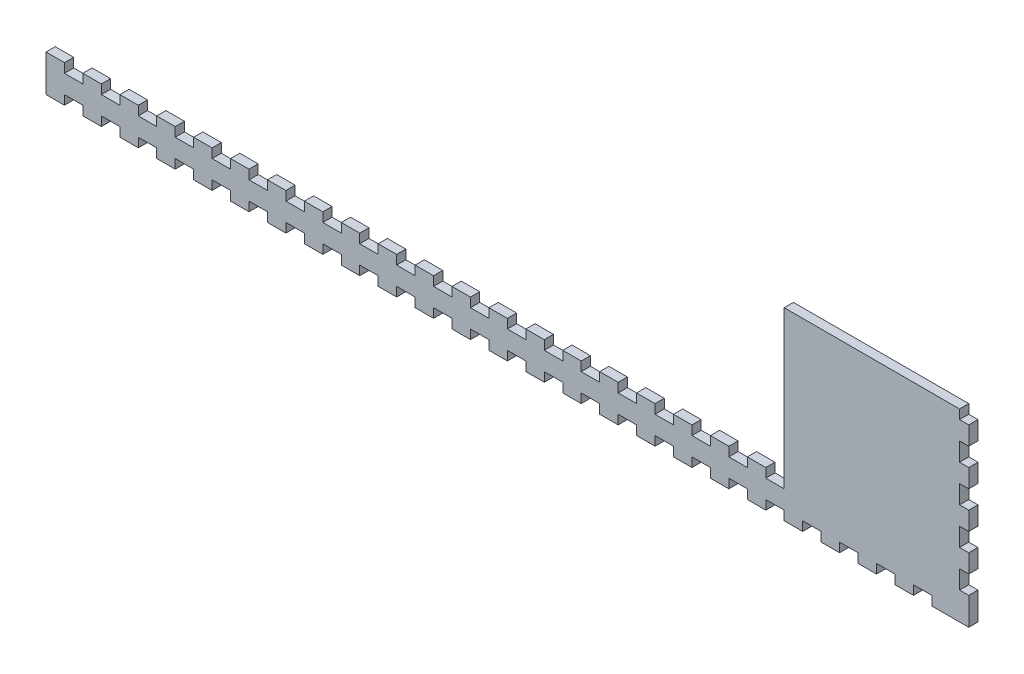
from build123d import *

# Parameters (mm, degrees)
BOSS_EXTRU_1_DEPTH      = 5
ESQUISSE2_W             = 10
ESQUISSE2_H             = 5
ESQUISSE2_W_2           = 5
ESQUISSE2_H_2           = 10
ENL_V_MAT_EXTRU_2_DEPTH = 266.753645318


with BuildPart() as part:
    # Esquisse1 → Boss.-Extru.1 (new body)
    with BuildSketch(Plane.XY):
        Polygon((-250, 10), (150, 10), (150, 90), (250, 90), (250, 10), (250, -10), (-250, -10), align=None)
    extrude(amount=BOSS_EXTRU_1_DEPTH)

    # Esquisse2 → Enlèv. mat.-Extru.2 (cut, through all)
    with BuildSketch(Plane.XY.offset(5)):
        with Locations((-235, 7.5)):
            Rectangle(ESQUISSE2_W, ESQUISSE2_H)
        with Locations((-235, -7.5)):
            Rectangle(ESQUISSE2_W, ESQUISSE2_H)
        with Locations((-215, 7.5)):
            Rectangle(ESQUISSE2_W, ESQUISSE2_H)
        with Locations((-215, -7.5)):
            Rectangle(ESQUISSE2_W, ESQUISSE2_H)
        with Locations((-195, 7.5)):
            Rectangle(ESQUISSE2_W, ESQUISSE2_H)
        with Locations((-195, -7.5)):
            Rectangle(ESQUISSE2_W, ESQUISSE2_H)
        with Locations((-175, 7.5)):
            Rectangle(ESQUISSE2_W, ESQUISSE2_H)
        with Locations((-175, -7.5)):
            Rectangle(ESQUISSE2_W, ESQUISSE2_H)
        with Locations((-155, 7.5)):
            Rectangle(ESQUISSE2_W, ESQUISSE2_H)
        with Locations((-155, -7.5)):
            Rectangle(ESQUISSE2_W, ESQUISSE2_H)
        with Locations((-135, 7.5)):
            Rectangle(ESQUISSE2_W, ESQUISSE2_H)
        with Locations((-135, -7.5)):
            Rectangle(ESQUISSE2_W, ESQUISSE2_H)
        with Locations((-115, 7.5)):
            Rectangle(ESQUISSE2_W, ESQUISSE2_H)
        with Locations((-115, -7.5)):
            Rectangle(ESQUISSE2_W, ESQUISSE2_H)
        with Locations((-95, 7.5)):
            Rectangle(ESQUISSE2_W, ESQUISSE2_H)
        with Locations((-95, -7.5)):
            Rectangle(ESQUISSE2_W, ESQUISSE2_H)
        with Locations((-75, 7.5)):
            Rectangle(ESQUISSE2_W, ESQUISSE2_H)
        with Locations((-75, -7.5)):
            Rectangle(ESQUISSE2_W, ESQUISSE2_H)
        with Locations((-55, 7.5)):
            Rectangle(ESQUISSE2_W, ESQUISSE2_H)
        with Locations((-55, -7.5)):
            Rectangle(ESQUISSE2_W, ESQUISSE2_H)
        with Locations((-35, 7.5)):
            Rectangle(ESQUISSE2_W, ESQUISSE2_H)
        with Locations((-35, -7.5)):
            Rectangle(ESQUISSE2_W, ESQUISSE2_H)
        with Locations((-15, 7.5)):
            Rectangle(ESQUISSE2_W, ESQUISSE2_H)
        with Locations((-15, -7.5)):
            Rectangle(ESQUISSE2_W, ESQUISSE2_H)
        with Locations((5, 7.5)):
            Rectangle(ESQUISSE2_W, ESQUISSE2_H)
        with Locations((5, -7.5)):
            Rectangle(ESQUISSE2_W, ESQUISSE2_H)
        with Locations((25, 7.5)):
            Rectangle(ESQUISSE2_W, ESQUISSE2_H)
        with Locations((25, -7.5)):
            Rectangle(ESQUISSE2_W, ESQUISSE2_H)
        with Locations((45, 7.5)):
            Rectangle(ESQUISSE2_W, ESQUISSE2_H)
        with Locations((45, -7.5)):
            Rectangle(ESQUISSE2_W, ESQUISSE2_H)
        with Locations((65, 7.5)):
            Rectangle(ESQUISSE2_W, ESQUISSE2_H)
        with Locations((65, -7.5)):
            Rectangle(ESQUISSE2_W, ESQUISSE2_H)
        with Locations((85, 7.5)):
            Rectangle(ESQUISSE2_W, ESQUISSE2_H)
        with Locations((85, -7.5)):
            Rectangle(ESQUISSE2_W, ESQUISSE2_H)
        with Locations((105, 7.5)):
            Rectangle(ESQUISSE2_W, ESQUISSE2_H)
        with Locations((105, -7.5)):
            Rectangle(ESQUISSE2_W, ESQUISSE2_H)
        with Locations((125, 7.5)):
            Rectangle(ESQUISSE2_W, ESQUISSE2_H)
        with Locations((125, -7.5)):
            Rectangle(ESQUISSE2_W, ESQUISSE2_H)
        with Locations((145, 7.5)):
            Rectangle(ESQUISSE2_W, ESQUISSE2_H)
        with Locations((145, -7.5)):
            Rectangle(ESQUISSE2_W, ESQUISSE2_H)
        with Locations((165, -7.5)):
            Rectangle(ESQUISSE2_W, ESQUISSE2_H)
        with Locations((185, -7.5)):
            Rectangle(ESQUISSE2_W, ESQUISSE2_H)
        with Locations((205, -7.5)):
            Rectangle(ESQUISSE2_W, ESQUISSE2_H)
        with Locations((225, -7.5)):
            Rectangle(ESQUISSE2_W, ESQUISSE2_H)
        with Locations((247.5, 10)):
            Rectangle(ESQUISSE2_W_2, ESQUISSE2_H_2)
        with Locations((247.5, 30)):
            Rectangle(ESQUISSE2_W_2, ESQUISSE2_H_2)
        with Locations((247.5, 50)):
            Rectangle(ESQUISSE2_W_2, ESQUISSE2_H_2)
        with Locations((247.5, 70)):
            Rectangle(ESQUISSE2_W_2, ESQUISSE2_H_2)
        with Locations((247.5, 90)):
            Rectangle(ESQUISSE2_W_2, ESQUISSE2_H_2)
    extrude(amount=-ENL_V_MAT_EXTRU_2_DEPTH, mode=Mode.SUBTRACT)


solid = part.part
